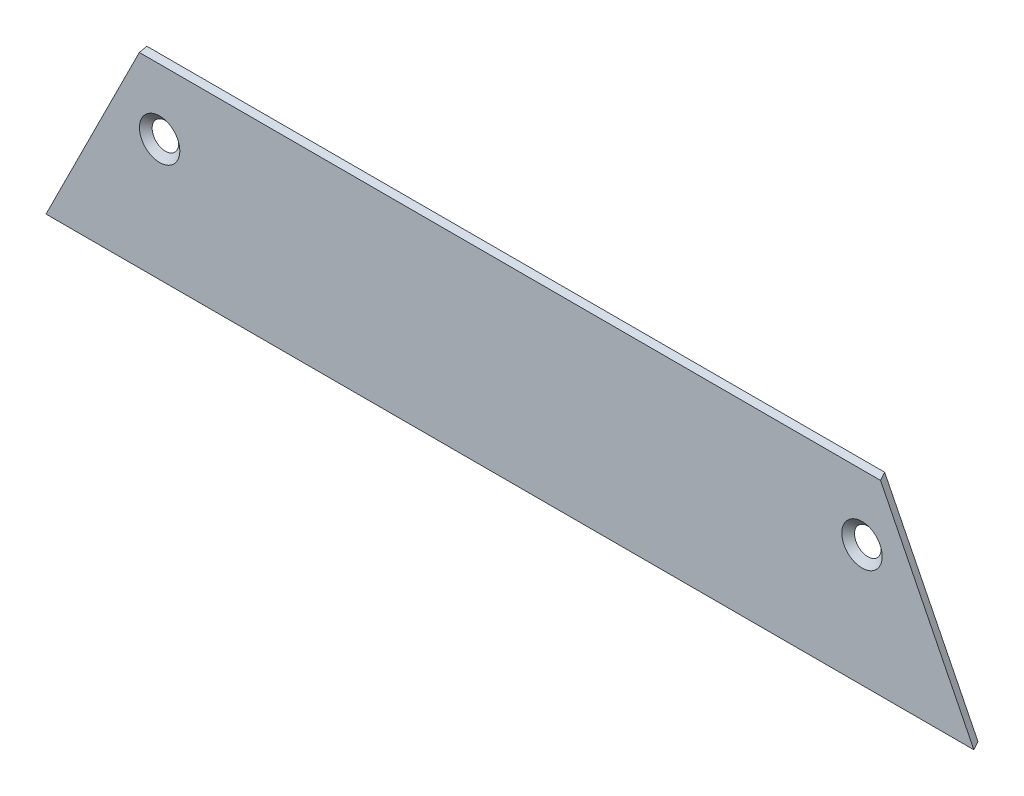
from build123d import *

# Parameters (mm, degrees)
BOSS_EXTRUDE2_DEPTH                       = 162.814
CUT_EXTRUDE1_DEPTH                        = 166.821138692
CSK_FOR_6_FLAT_HEAD_MACHINE_SCREW_2_COUNT = 2
CSK_FOR_6_FLAT_HEAD_MACHINE_SCREW_2_PITCH = 123.248406325


with BuildPart() as part:
    # Sketch3 → Boss-Extrude2 (new body)
    with BuildSketch(Plane(origin=(0, 0, 0), x_dir=(0, 0, -1), z_dir=(1, 0, 0))):
        Polygon((-0.5715, 31.420044321), (-1.5875, 30.833456448), (-1.5875, -1.917455679), (-0.5715, -1.330867805), align=None)
    extrude(amount=BOSS_EXTRUDE2_DEPTH)

    # Sketch5 → Cut-Extrude1 (cut, through all)
    with BuildSketch(Plane.XY.offset(1.5875)):
        Polygon((0, -1.917455679), (16.672349491, 31.420044321), (0, 31.420044321), align=None)
        Polygon((162.814, -1.917455679), (146.141650509, 31.420044321), (162.814, 31.420044321), align=None)
    extrude(amount=-CUT_EXTRUDE1_DEPTH, mode=Mode.SUBTRACT)

    # Sketch7 → CSK for #6 Flat Head Machine Screw (100)1 (revolve, cut)
    with BuildSketch(Plane(origin=(19.939, 19.426957216, 1.5875), x_dir=(0, -1, 0), z_dir=(1, 0, 0))):
        Polygon((0, 0), (0, 1.016), (1.89865, 1.016), (1.89865, 1.380025208), (3.5433, 0), align=None)
    csk_for_6_flat_head_machine_screw_100 = revolve(axis=Axis((19.939, 19.426957216, 7.9375), (0, 0, -1)), mode=Mode.SUBTRACT)

    # CSK for _6 Flat Head Machine Screw _ 2: CSK for #6 Flat Head Machine Screw (100)1 ×2
    with Locations(*[(i * CSK_FOR_6_FLAT_HEAD_MACHINE_SCREW_2_PITCH, 0, 0) for i in range(1, CSK_FOR_6_FLAT_HEAD_MACHINE_SCREW_2_COUNT)]):
        add(csk_for_6_flat_head_machine_screw_100, mode=Mode.SUBTRACT)


solid = part.part
